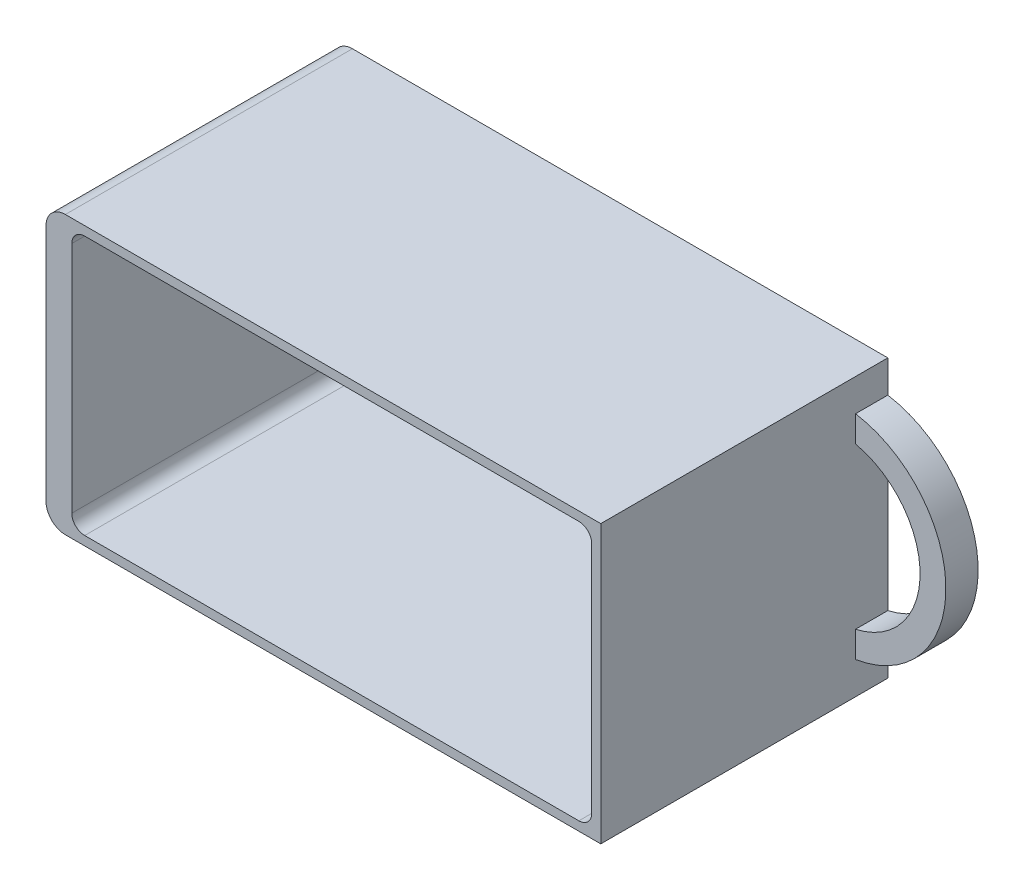
from build123d import *

# Parameters (mm, degrees)
SKETCH_1_W                  = 86
SKETCH_1_H                  = 43
EXTRUDE_1_DEPTH             = 39.5
EXTRUDE_2_DEPTH             = 5
SKETCH_3_W                  = 80.6
SKETCH_3_H                  = 40.2
CUT_EXTRUDE_1_DEPTH         = 43.6
HOLE_WIZARD_8_3_8_3_1_D     = 8.3
HOLE_WIZARD_8_3_8_3_1_DEPTH = 3.2
FILLET_1_R                  = 3
EXTRUDE_START               = -4
SKETCH_6_R                  = 4.15
EXTRUDE_3_DEPTH             = 4
FILLET_2_R                  = 2


with BuildPart() as part:
    # Эскиз1 → Бобышка-Вытянуть1 (new body)
    with BuildSketch(Plane.XY.offset(22.25)):
        with Locations((47, 0)):
            Rectangle(SKETCH_1_W, SKETCH_1_H)
    extrude(amount=-EXTRUDE_1_DEPTH)

    # Эскиз2 → Бобышка-Вытянуть2 (add)
    with BuildSketch(Plane(origin=(0, 0, -17.25), x_dir=(-1, 0, 0), z_dir=(0, 0, -1))):
        with BuildLine():
            Line((-90, -21.5), (-90, -16.5))
            ThreePointArc((-90, -16.5), (-104, 0), (-90, 16.5))
            Line((-90, 16.5), (-90, 21.5))
            Line((-90, 21.5), (-4, 21.5))
            Line((-4, 21.5), (-4, -21.5))
            Line((-4, -21.5), (-90, -21.5))
        make_face()
        with BuildLine():
            Line((-90, -12.428366172), (-90, 12.428366172))
            ThreePointArc((-90, 12.428366172), (-100, 0), (-90, -12.428366172))
        make_face(mode=Mode.SUBTRACT)
    extrude(amount=EXTRUDE_2_DEPTH)

    # Эскиз3 → Вырез-Вытянуть1 (cut)
    with BuildSketch(Plane.XY.offset(22.25)):
        with Locations((48.3, 0)):
            Rectangle(SKETCH_3_W, SKETCH_3_H)
    extrude(amount=-CUT_EXTRUDE_1_DEPTH, mode=Mode.SUBTRACT)

    # Диаметр отверстия Ø8.3 (8.3)1
    with Locations(Plane.ZY.offset(-4)):
        with Locations((0, 0)):
            Hole(HOLE_WIZARD_8_3_8_3_1_D / 2, depth=HOLE_WIZARD_8_3_8_3_1_DEPTH)

    # Скругление1
    fillet_1_edges = [part.edges().sort_by_distance(p)[0] for p in [
        (4, -21.5, 0),
        (4, 21.5, 0),
    ]]
    fillet(fillet_1_edges, radius=FILLET_1_R)

    # Эскиз6 → Бобышка-Вытянуть3 (add)
    with BuildSketch(Plane.ZY.offset(-4).offset(EXTRUDE_START)):
        Circle(SKETCH_6_R)
    extrude(amount=EXTRUDE_3_DEPTH)

    # Скругление2
    fillet_2_edges = [part.edges().sort_by_distance(p)[0] for p in [
        (48.3, -20.1, -21.35),
        (88.6, -20.1, 0.45),
        (8, 0, -21.35),
        (8, -20.1, 0.45),
        (48.3, 20.1, -21.35),
        (8, 20.1, 0.45),
        (88.6, 0, -21.35),
        (88.6, 20.1, 0.45),
    ]]
    fillet(fillet_2_edges, radius=FILLET_2_R)


solid = part.part
